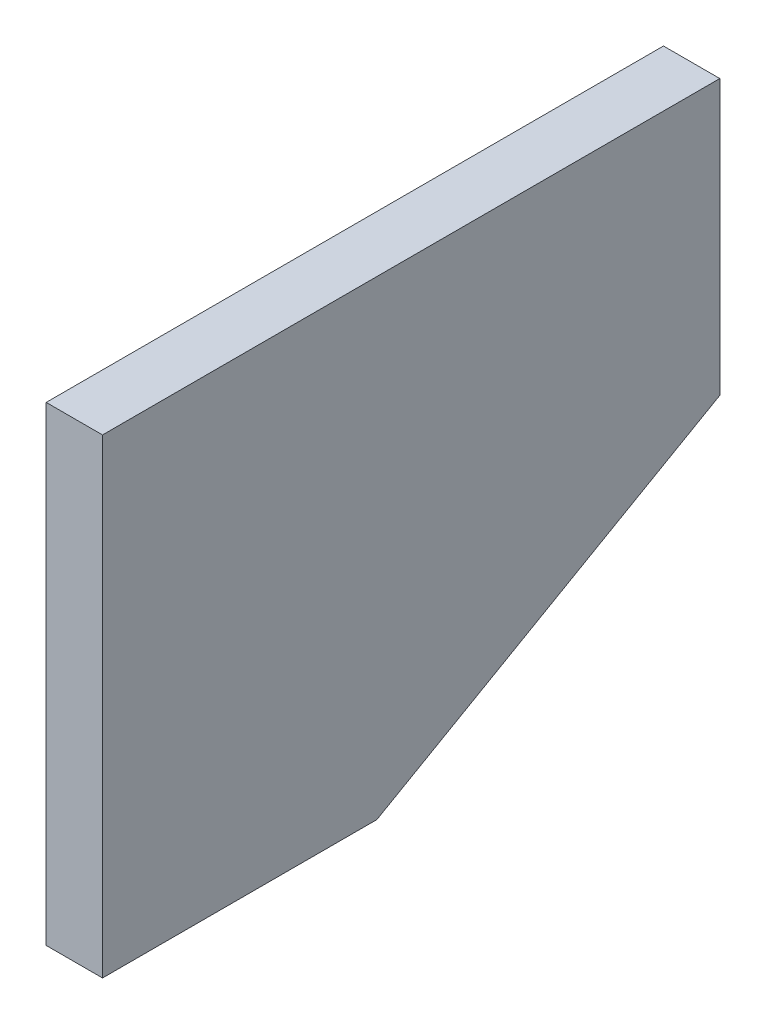
from build123d import *

# Parameters (mm, degrees)
BOSS_EXTRUDE1_DEPTH = 18.25625


with BuildPart() as part:
    # Sketch1 → Boss-Extrude1 (new body)
    with BuildSketch(Plane(origin=(0, 0, 0), x_dir=(0, 0, -1), z_dir=(1, 0, 0))):
        Polygon((0, 0), (200.025, 0), (200.025, -88.9), (88.9, -152.4), (0, -152.4), align=None)
    extrude(amount=BOSS_EXTRUDE1_DEPTH)


solid = part.part
